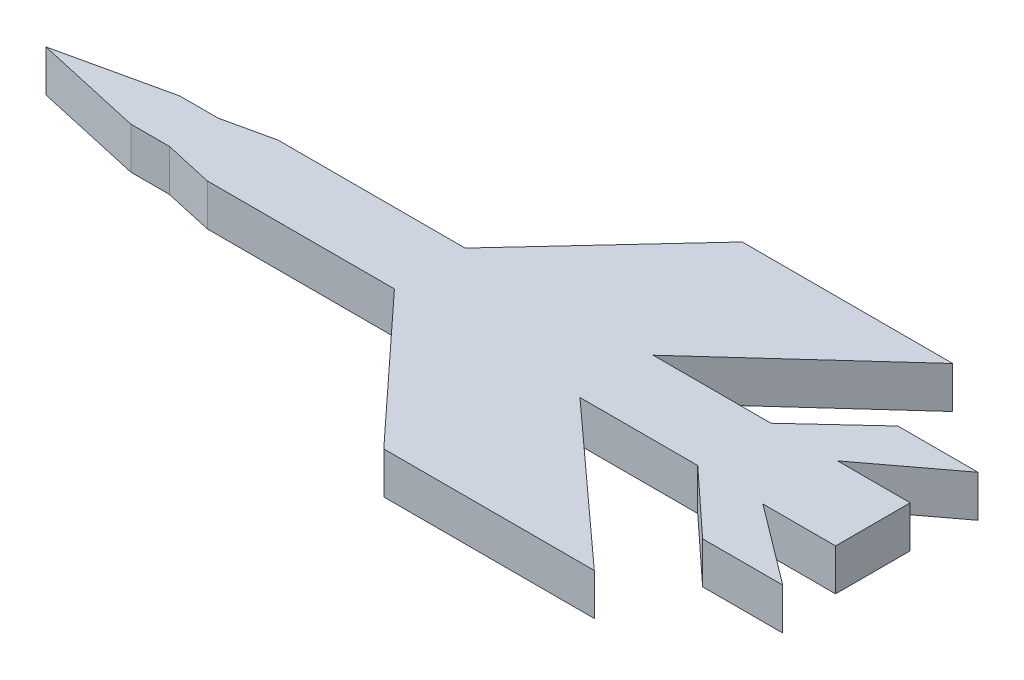
from build123d import *

# Parameters (mm, degrees)
BOSS_EXTRUDE1_DEPTH = 2


with BuildPart() as part:
    # Sketch1 → Boss-Extrude1 (new body)
    with BuildSketch(Plane(origin=(0, 0, 0), x_dir=(1, 0, 0), z_dir=(0, 1, 0))):
        Polygon((2.196559053, 0), (7.452931296, 1.175010029), (9.303594094, 1.175010029), (11.651098899, 1.699771512), (20.648577937, 1.699771512), (27.055150767, 8.61778788), (37.17663195, 8.61778788), (29.627647976, 1.759990212), (35.292450042, 1.759990212), (38.461743589, 4.694980366), (42.313765477, 4.694980366), (38.461743589, 1.79432624), (41.955192877, 1.79432624), (41.955192877, -1.79432624), (38.461743589, -1.79432624), (42.313765477, -4.694980366), (38.461743589, -4.694980366), (35.292450042, -1.759990212), (29.627647976, -1.759990212), (37.17663195, -8.61778788), (27.055150767, -8.61778788), (20.648577937, -1.699771512), (11.651098899, -1.699771512), (9.303594094, -1.175010029), (7.452931296, -1.175010029), align=None)
    extrude(amount=BOSS_EXTRUDE1_DEPTH)


solid = part.part
